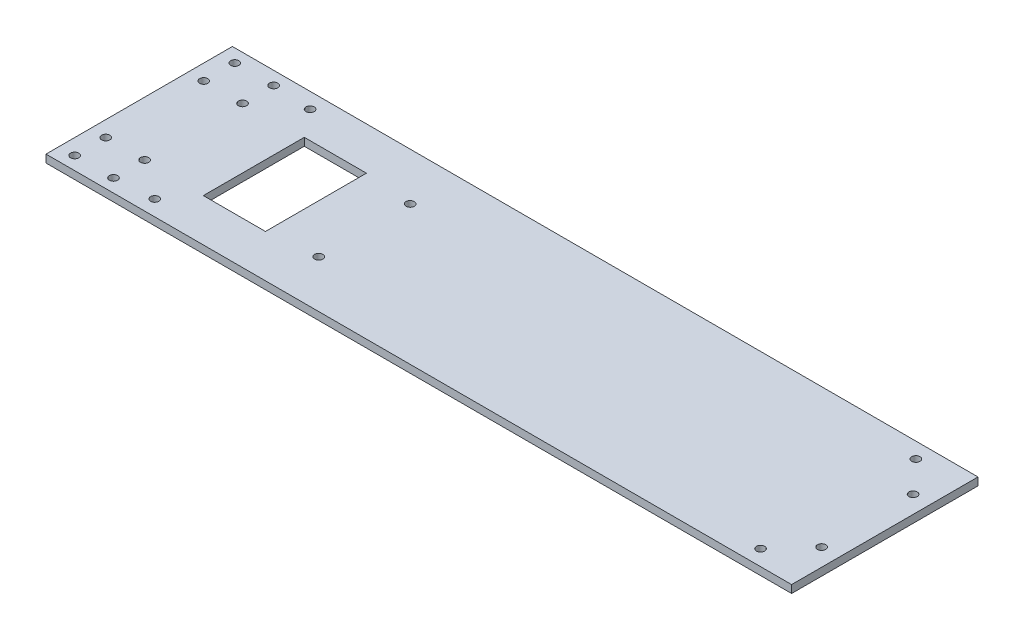
from build123d import *

# Parameters (mm, degrees)
SKETCH2_W           = 609.6
SKETCH2_H           = 152.4
BOSS_EXTRUDE1_DEPTH = 6.35
CUT_EXTRUDE1_REACH  = 630.393
SKETCH3_W           = 50.8
SKETCH3_H           = 82.55
SKETCH4_R           = 3.3782
CUT_EXTRUDE2_DEPTH  = 629.393381967
SKETCH5_R           = 3.3782
CUT_EXTRUDE3_DEPTH  = 629.393381967
SKETCH6_R           = 3.3782
CUT_EXTRUDE4_DEPTH  = 629.393381967


with BuildPart() as part:
    # Sketch2 → Boss-Extrude1 (new body)
    with BuildSketch(Plane(origin=(0, 0, 0), x_dir=(1, 0, 0), z_dir=(0, 1, 0))):
        with Locations((304.8, 76.2)):
            Rectangle(SKETCH2_W, SKETCH2_H)
    extrude(amount=BOSS_EXTRUDE1_DEPTH)

    # Sketch3 → Cut-Extrude1 (cut, up to next)
    with BuildSketch(Plane(origin=(0, 6.35, 0), x_dir=(1, 0, 0), z_dir=(0, 1, 0)), mode=Mode.PRIVATE) as cut_extrude1_sk1:
        with Locations((119.1006, 76.2)):
            Rectangle(SKETCH3_W, SKETCH3_H)
    cut_extrude1_tool1 = extrude(cut_extrude1_sk1.sketch, amount=-CUT_EXTRUDE1_REACH, mode=Mode.PRIVATE) & part.part
    add(cut_extrude1_tool1.solids().sort_by_distance((119.1006, 6.35, -76.2))[0], mode=Mode.SUBTRACT)

    # Sketch4 → Cut-Extrude2 (cut, through all)
    with BuildSketch(Plane(origin=(0, 6.35, 0), x_dir=(1, 0, 0), z_dir=(0, 1, 0))):
        with Locations(Location((571.5, 12.7, 0), (0, 0, 270))):
            Circle(SKETCH4_R)
        with Locations(Location((571.5, 139.7, 0), (0, 0, 270))):
            Circle(SKETCH4_R)
        with Locations(Location((76.2, 12.7, 0), (0, 0, 270))):
            Circle(SKETCH4_R)
        with Locations(Location((76.2, 139.7, 0), (0, 0, 270))):
            Circle(SKETCH4_R)
    extrude(amount=-CUT_EXTRUDE2_DEPTH, mode=Mode.SUBTRACT)

    # Sketch5 → Cut-Extrude3 (cut, through all)
    with BuildSketch(Plane(origin=(0, 6.35, 0), x_dir=(1, 0, 0), z_dir=(0, 1, 0))):
        with Locations(Location((595.3125, 113.587796728, 0), (0, 0, 270))):
            Circle(SKETCH5_R)
        with Locations(Location((595.3125, 38.812203272, 0), (0, 0, 270))):
            Circle(SKETCH5_R)
        with Locations(Location((184.15, 38.812203272, 0), (0, 0, 270))):
            Circle(SKETCH5_R)
        with Locations(Location((184.15, 113.587796728, 0), (0, 0, 270))):
            Circle(SKETCH5_R)
    extrude(amount=-CUT_EXTRUDE3_DEPTH, mode=Mode.SUBTRACT)

    # Sketch6 → Cut-Extrude4 (cut, through all)
    with BuildSketch(Plane(origin=(0, 6.35, 0), x_dir=(1, 0, 0), z_dir=(0, 1, 0))):
        with Locations(Location((12.7, 36.14928, 0), (0, 0, 270))):
            Circle(SKETCH6_R)
        with Locations(Location((12.7, 10.74928, 0), (0, 0, 270))):
            Circle(SKETCH6_R)
        with Locations(Location((44.45, 10.74928, 0), (0, 0, 270))):
            Circle(SKETCH6_R)
        with Locations(Location((44.45, 36.14928, 0), (0, 0, 270))):
            Circle(SKETCH6_R)
        with Locations(Location((12.7, 141.65072, 0), (0, 0, 270))):
            Circle(SKETCH6_R)
        with Locations(Location((12.7, 116.25072, 0), (0, 0, 270))):
            Circle(SKETCH6_R)
        with Locations(Location((44.45, 116.25072, 0), (0, 0, 270))):
            Circle(SKETCH6_R)
        with Locations(Location((44.45, 141.65072, 0), (0, 0, 270))):
            Circle(SKETCH6_R)
    extrude(amount=-CUT_EXTRUDE4_DEPTH, mode=Mode.SUBTRACT)


solid = part.part
